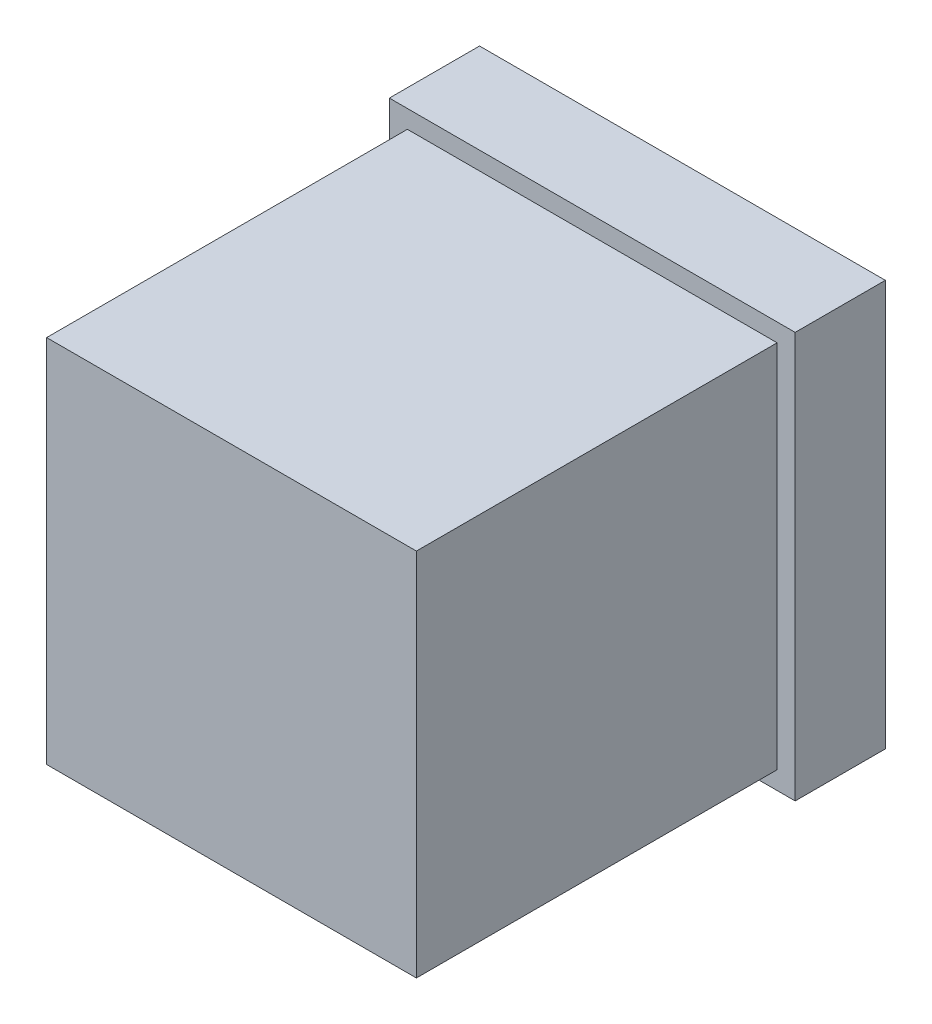
from build123d import *

# Parameters (mm, degrees)
CROQUIS1_W              = 45
CROQUIS1_H              = 45
SALIENTE_EXTRUIR1_DEPTH = 10
CROQUIS2_W              = 41
CROQUIS2_H              = 41
SALIENTE_EXTRUIR2_DEPTH = 40


with BuildPart() as part:
    # Croquis1 → Saliente-Extruir1 (new body)
    with BuildSketch(Plane.XY):
        with Locations((22.5, 22.5)):
            Rectangle(CROQUIS1_W, CROQUIS1_H)
    extrude(amount=SALIENTE_EXTRUIR1_DEPTH)

    # Croquis2 → Saliente-Extruir2 (add)
    with BuildSketch(Plane.XY.offset(10)):
        with Locations((22.5, 22.5)):
            Rectangle(CROQUIS2_W, CROQUIS2_H)
    extrude(amount=SALIENTE_EXTRUIR2_DEPTH)


solid = part.part
